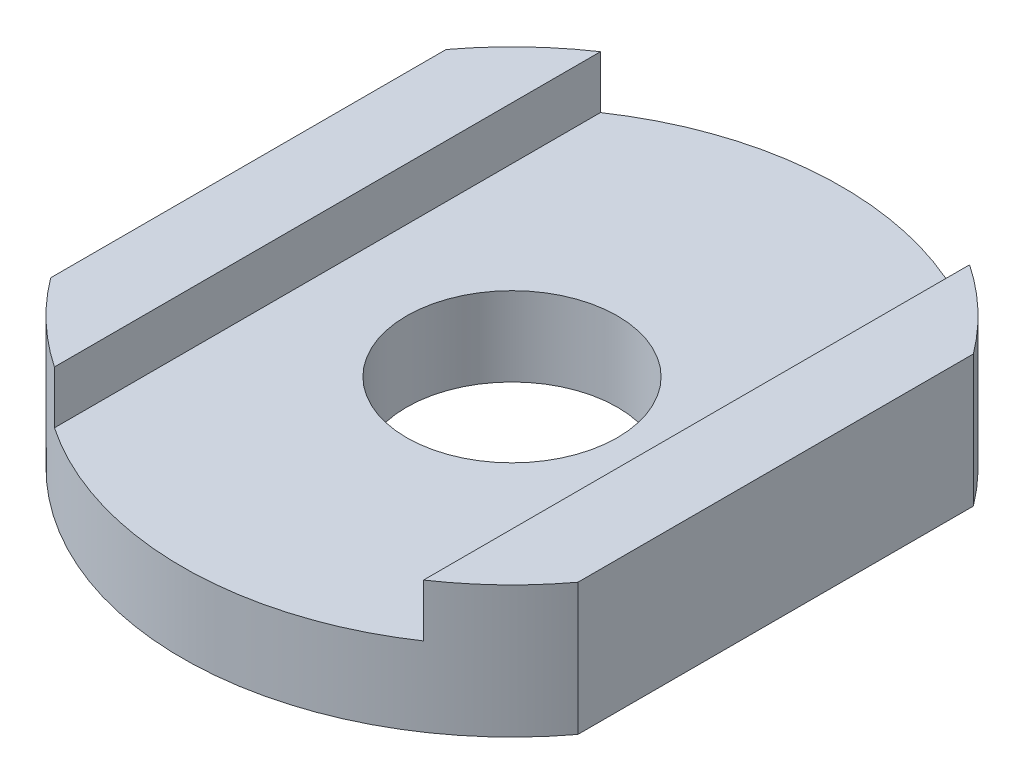
from build123d import *

# Parameters (mm, degrees)
SKETCH1_R           = 4
BOSS_EXTRUDE1_DEPTH = 3
BOSS_EXTRUDE2_DEPTH = 5


with BuildPart() as part:
    # Sketch1 → Boss-Extrude1 (new body)
    with BuildSketch(Plane(origin=(0, 0, 0), x_dir=(1, 0, 0), z_dir=(0, 1, 0))):
        with BuildLine():
            Line((10, -7.5), (10, 7.5))
            ThreePointArc((10, 7.5), (0, 12.5), (-10, 7.5))
            Line((-10, 7.5), (-10, -7.5))
            ThreePointArc((-10, -7.5), (0, -12.5), (10, -7.5))
        make_face()
        Circle(SKETCH1_R, mode=Mode.SUBTRACT)
    extrude(amount=BOSS_EXTRUDE1_DEPTH)

    # Sketch1<3> → Boss-Extrude2 (add)
    with BuildSketch(Plane(origin=(0, 0, 0), x_dir=(1, 0, 0), z_dir=(0, 1, 0))):
        with BuildLine():
            Line((-10, 7.5), (-10, -7.5))
            ThreePointArc((-10, -7.5), (-8.619130411, -9.053208876), (-7, -10.356157589))
            Line((-7, -10.356157589), (-7, 10.356157589))
            ThreePointArc((-7, 10.356157589), (-8.619130411, 9.053208876), (-10, 7.5))
        make_face()
        with BuildLine():
            Line((7, 10.356157589), (7, -10.356157589))
            ThreePointArc((7, -10.356157589), (8.619130411, -9.053208876), (10, -7.5))
            Line((10, -7.5), (10, 7.5))
            ThreePointArc((10, 7.5), (8.619130411, 9.053208876), (7, 10.356157589))
        make_face()
    extrude(amount=BOSS_EXTRUDE2_DEPTH)


solid = part.part
